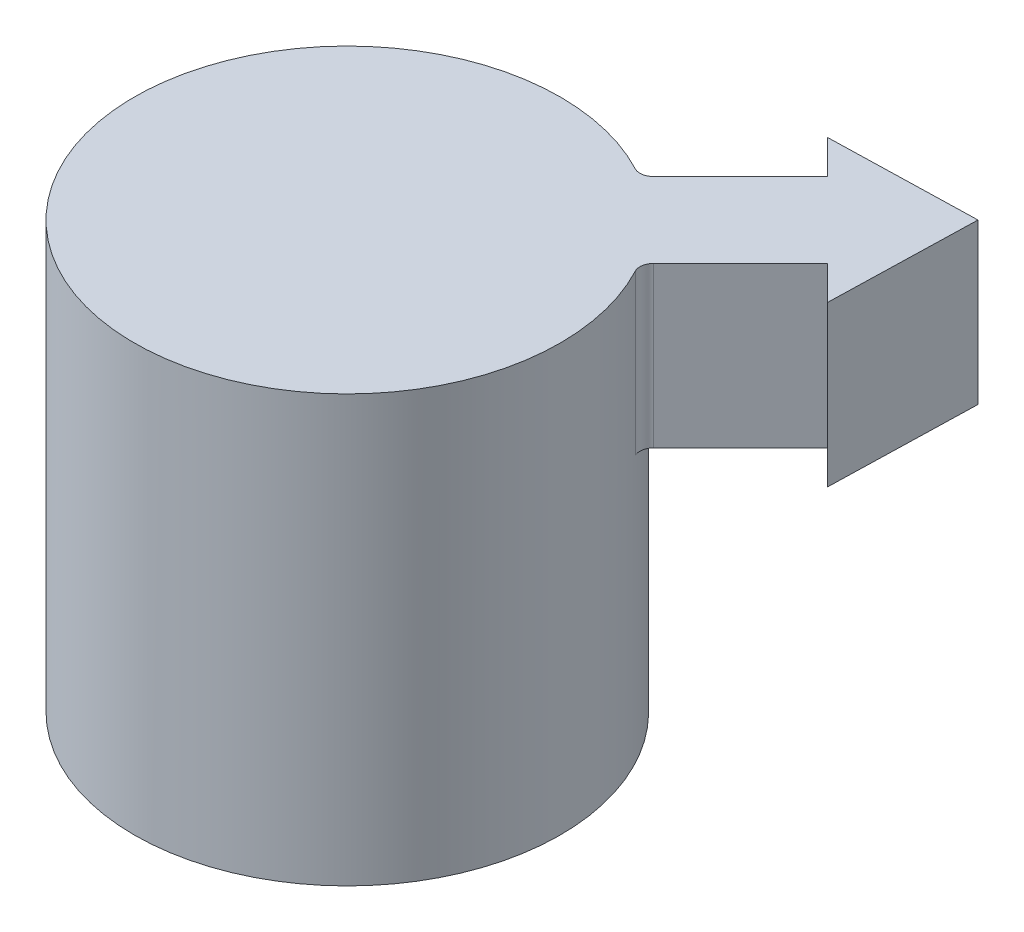
from build123d import *

# Parameters (mm, degrees)
SKETCH1_R           = 8
BOSS_EXTRUDE1_DEPTH = 16
SKETCH2_R           = 5.6
CUT_EXTRUDE1_DEPTH  = 12
BOSS_EXTRUDE2_START = -6
BOSS_EXTRUDE2_DEPTH = 6


with BuildPart() as part:
    # Sketch1 → Boss-Extrude1 (new body)
    with BuildSketch(Plane(origin=(0, 0, 0), x_dir=(1, 0, 0), z_dir=(0, 1, 0))):
        Circle(SKETCH1_R)
    extrude(amount=BOSS_EXTRUDE1_DEPTH)

    # Sketch2 → Cut-Extrude1 (cut)
    with BuildSketch(Plane.XZ):
        Circle(SKETCH2_R)
    extrude(amount=-CUT_EXTRUDE1_DEPTH, mode=Mode.SUBTRACT)

    # Sketch4 → Boss-Extrude2 (add)
    with BuildSketch(Plane(origin=(0, 16, 0), x_dir=(1, 0, 0), z_dir=(0, 1, 0)).offset(BOSS_EXTRUDE2_START)):
        with BuildLine():
            Line((7.598545919, 10.426973043), (4.330349084, 7.158776209))
            ThreePointArc((4.330349084, 7.158776209), (4.05115191, 7.017889357), (3.742866535, 7.070427858))
            ThreePointArc((3.742866535, 7.070427858), (-5.656854249, -5.656854249), (7.070427858, 3.742866535))
            ThreePointArc((7.070427858, 3.742866535), (7.017889357, 4.05115191), (7.158776209, 4.330349084))
            Line((7.158776209, 4.330349084), (10.426973043, 7.598545919))
            Line((10.426973043, 7.598545919), (11.696836602, 6.32868236))
            Line((11.696836602, 6.32868236), (11.841186606, 11.841186606))
            Line((11.841186606, 11.841186606), (6.325753712, 11.699765249))
            Line((6.325753712, 11.699765249), (7.598545919, 10.426973043))
        make_face()
    extrude(amount=BOSS_EXTRUDE2_DEPTH)


solid = part.part
